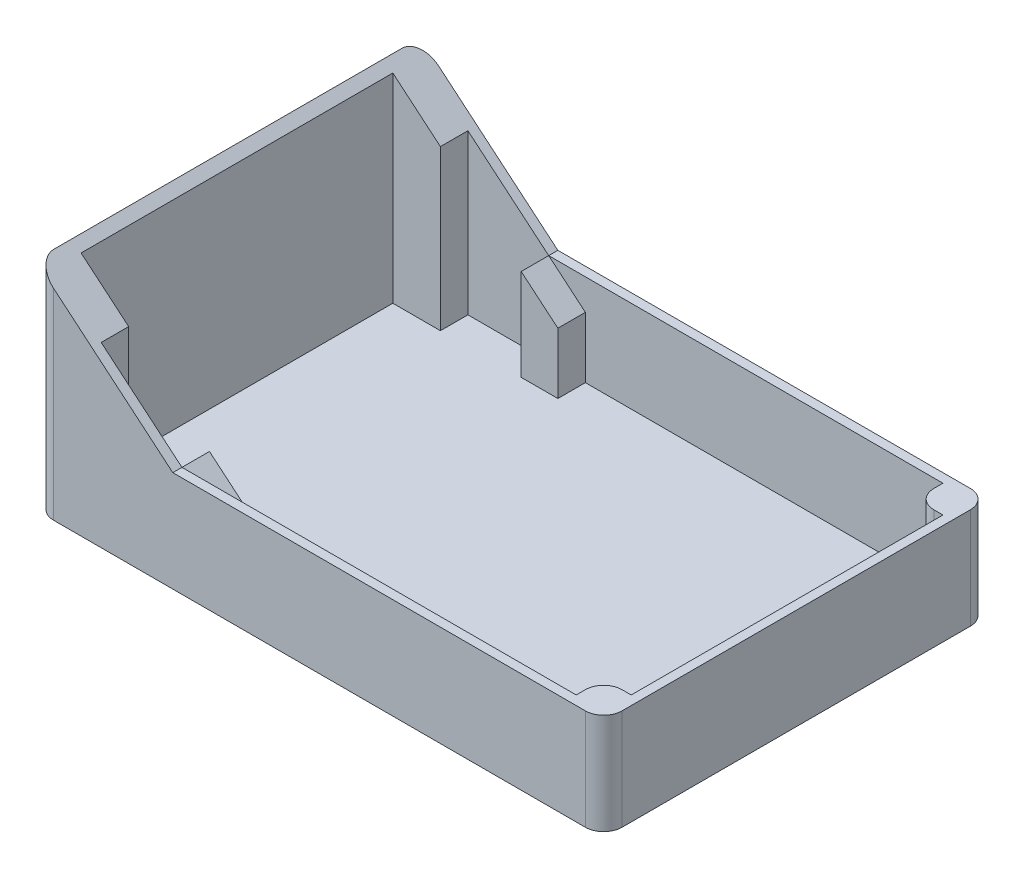
from build123d import *

# Parameters (mm, degrees)
SKETCH1_W            = 124
SKETCH1_H            = 84
SKETCH1_W_2          = 120
SKETCH1_H_2          = 80
EXTRUDE_THIN1_DEPTH  = 20
SKETCH2_W            = 124
SKETCH2_H            = 84
BOSS_EXTRUDE1_DEPTH  = 2
BOSS_EXTRUDE2_DEPTH  = 6
SKETCH9_W            = 6
SKETCH9_H            = 6
BOSS_EXTRUDE7_DEPTH  = 20
BOSS_EXTRUDE8_DEPTH  = 2
BOSS_EXTRUDE9_START  = -2
BOSS_EXTRUDE9_DEPTH  = 6
BOSS_EXTRUDE10_DEPTH = 68
FILLET1_R            = 4


with BuildPart() as part:
    # Sketch1 → Extrude-Thin1 (new body)
    with BuildSketch(Plane(origin=(0, 0, 0), x_dir=(1, 0, 0), z_dir=(0, 1, 0))):
        Rectangle(SKETCH1_W, SKETCH1_H)
        Rectangle(SKETCH1_W_2, SKETCH1_H_2, mode=Mode.SUBTRACT)
    extrude(amount=EXTRUDE_THIN1_DEPTH)

    # Sketch2 → Boss-Extrude1 (add)
    with BuildSketch(Plane.XZ):
        Rectangle(SKETCH2_W, SKETCH2_H)
    extrude(amount=BOSS_EXTRUDE1_DEPTH)

    # Sketch3 → Boss-Extrude2 (add)
    with BuildSketch(Plane.XY.offset(-40)):
        Polygon((-24, 13.287202951), (-24, -2), (-32, -2), (-32, 20), align=None)
    boss_extrude2 = extrude(amount=BOSS_EXTRUDE2_DEPTH)

    # Sketch9 → Boss-Extrude7 (add)
    with BuildSketch(Plane(origin=(0, 20, 0), x_dir=(1, 0, 0), z_dir=(0, 1, 0))):
        with Locations((57, 37)):
            Rectangle(SKETCH9_W, SKETCH9_H)
        with Locations((57, -37)):
            Rectangle(SKETCH9_W, SKETCH9_H)
    extrude(amount=-BOSS_EXTRUDE7_DEPTH)

    # Sketch10 → Boss-Extrude8 (add)
    with BuildSketch(Plane(origin=(0, 0, -42), x_dir=(-1, 0, 0), z_dir=(0, 0, -1))):
        Polygon((62, 20), (62, 45.172988935), (32, 20), align=None)
    boss_extrude8 = extrude(amount=-BOSS_EXTRUDE8_DEPTH)

    # Sketch11 → Boss-Extrude9 (add)
    with BuildSketch(Plane(origin=(0, 0, -42), x_dir=(-1, 0, 0), z_dir=(0, 0, -1)).offset(BOSS_EXTRUDE9_START)):
        Polygon((62, 45.172988935), (49.619022192, 34.784115023), (49.619022192, -2), (62, -2), align=None)
    boss_extrude9 = extrude(amount=-BOSS_EXTRUDE9_DEPTH)

    # Mirror1: Boss-Extrude2, Boss-Extrude8, Boss-Extrude9 across plane
    add(boss_extrude2.mirror(Plane(origin=(0, 0, 0), x_dir=(1, 0, 0), z_dir=(0, 0, -1))))
    add(boss_extrude8.mirror(Plane(origin=(0, 0, 0), x_dir=(1, 0, 0), z_dir=(0, 0, -1))))
    add(boss_extrude9.mirror(Plane(origin=(0, 0, 0), x_dir=(1, 0, 0), z_dir=(0, 0, -1))))

    # Sketch12 → Boss-Extrude10 (add)
    with BuildSketch(Plane.XY.offset(-34)):
        Polygon((-62, 20), (-62, 45.172988935), (-60, 43.494789673), (-60, 20), align=None)
    extrude(amount=BOSS_EXTRUDE10_DEPTH)

    # Fillet1
    fillet1_edges = [part.edges().sort_by_distance(p)[0] for p in [
        (62, 9, 42),
        (-62, 21.586494468, 42),
        (-62, 21.586494468, -42),
        (62, 9, -42),
        (54, 10, -34),
        (54, 10, 34),
    ]]
    fillet(fillet1_edges, radius=FILLET1_R)


solid = part.part
